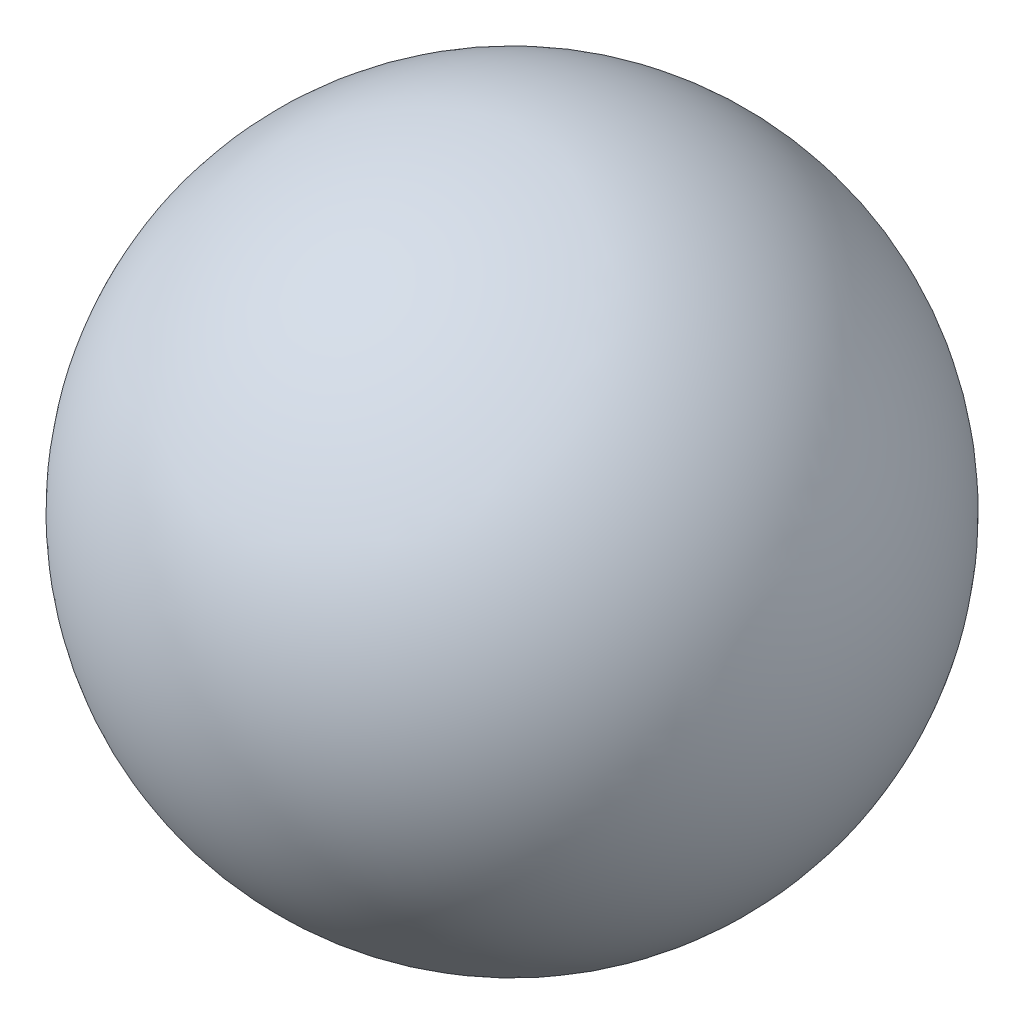
from build123d import *


with BuildPart() as part:
    # 草图1 → 旋转1 (revolve)
    with BuildSketch(Plane.XY):
        with BuildLine():
            Line((21.25, 0), (-21.25, 0))
            ThreePointArc((-21.25, 0), (0, 21.25), (21.25, 0))
        make_face()
    revolve(axis=Axis((21.25, 0, 0), (-1, 0, 0)))


solid = part.part
